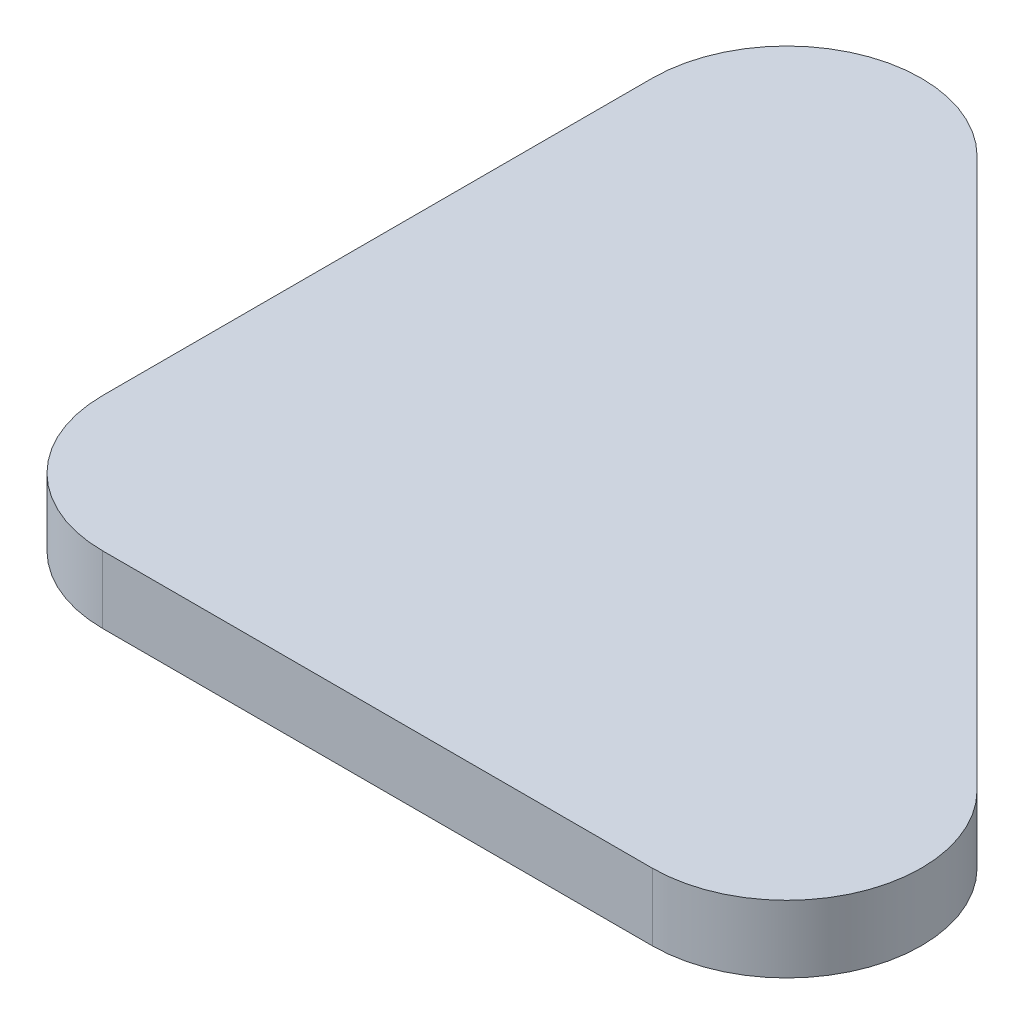
from build123d import *

# Parameters (mm, degrees)
EXTRUDE_1_DEPTH = 4
FILLET_1_R      = 8


with BuildPart() as part:
    # 草图1 → 凸台-拉伸1 (new body)
    with BuildSketch(Plane(origin=(0, 0, 0), x_dir=(1, 0, 0), z_dir=(0, 1, 0))):
        Polygon((0, 0), (60, 0), (0, 60), align=None)
    extrude(amount=EXTRUDE_1_DEPTH)

    # 圆角1
    fillet_1_edges = [part.edges().sort_by_distance(p)[0] for p in [
        (0, 2, -60),
        (60, 2, 0),
        (0, 2, 0),
    ]]
    fillet(fillet_1_edges, radius=FILLET_1_R)


solid = part.part
